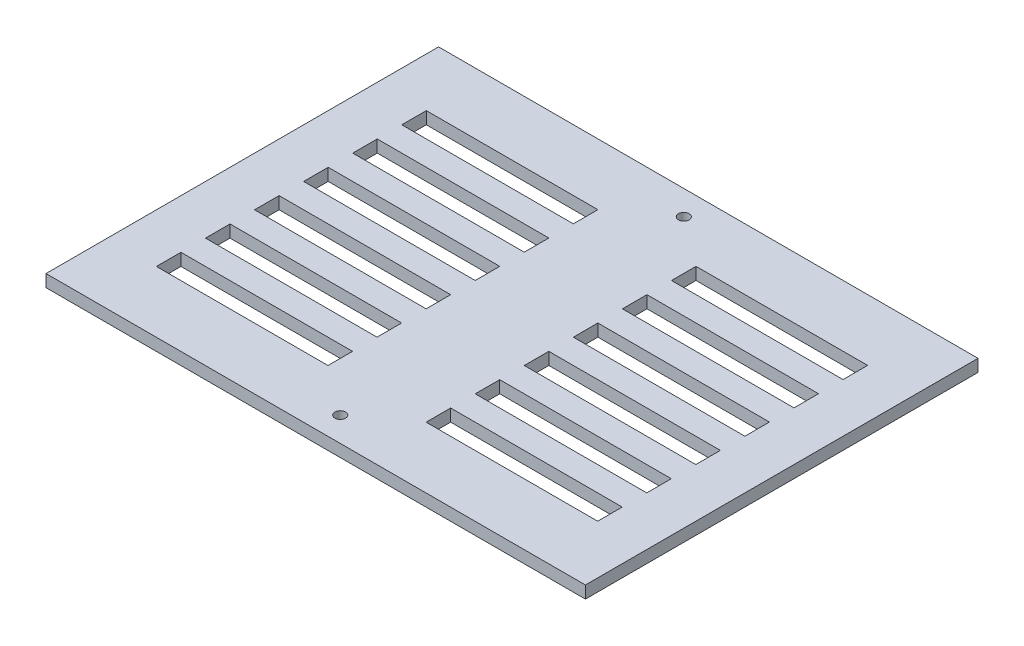
from build123d import *

# Parameters (mm, degrees)
SKETCH1_W           = 139.5984
SKETCH1_H           = 101.6
BOSS_EXTRUDE1_DEPTH = 3.175
SKETCH2_R           = 1.3843
SKETCH2_W           = 44.3992
SKETCH2_H           = 6.35
CUT_EXTRUDE1_DEPTH  = 3.175


with BuildPart() as part:
    # Sketch1 → Boss-Extrude1 (new body)
    with BuildSketch(Plane(origin=(0, 0, 0), x_dir=(1, 0, 0), z_dir=(0, 1, 0))):
        with Locations((0, 50.8)):
            Rectangle(SKETCH1_W, SKETCH1_H)
    extrude(amount=BOSS_EXTRUDE1_DEPTH)

    # Sketch2 → Cut-Extrude1 (cut)
    with BuildSketch(Plane(origin=(0, 3.175, 0), x_dir=(1, 0, 0), z_dir=(0, 1, 0))):
        with Locations(Location((0, 6.35, 0), (0, 0, 270))):
            Circle(SKETCH2_R)
        with Locations(Location((0, 95.25, 0), (0, 0, 270))):
            Circle(SKETCH2_R)
        with Locations((-34.8996, 82.55)):
            Rectangle(SKETCH2_W, SKETCH2_H)
        with Locations((-34.8996, 69.85)):
            Rectangle(SKETCH2_W, SKETCH2_H)
        with Locations((-34.8996, 57.15)):
            Rectangle(SKETCH2_W, SKETCH2_H)
        with Locations((-34.8996, 44.45)):
            Rectangle(SKETCH2_W, SKETCH2_H)
        with Locations((-34.8996, 31.75)):
            Rectangle(SKETCH2_W, SKETCH2_H)
        with Locations((-34.8996, 19.05)):
            Rectangle(SKETCH2_W, SKETCH2_H)
        with Locations((34.8996, 82.55)):
            Rectangle(SKETCH2_W, SKETCH2_H)
        with Locations((34.8996, 69.85)):
            Rectangle(SKETCH2_W, SKETCH2_H)
        with Locations((34.8996, 57.15)):
            Rectangle(SKETCH2_W, SKETCH2_H)
        with Locations((34.8996, 44.45)):
            Rectangle(SKETCH2_W, SKETCH2_H)
        with Locations((34.8996, 31.75)):
            Rectangle(SKETCH2_W, SKETCH2_H)
        with Locations((34.8996, 19.05)):
            Rectangle(SKETCH2_W, SKETCH2_H)
    extrude(amount=-CUT_EXTRUDE1_DEPTH, mode=Mode.SUBTRACT)


solid = part.part
